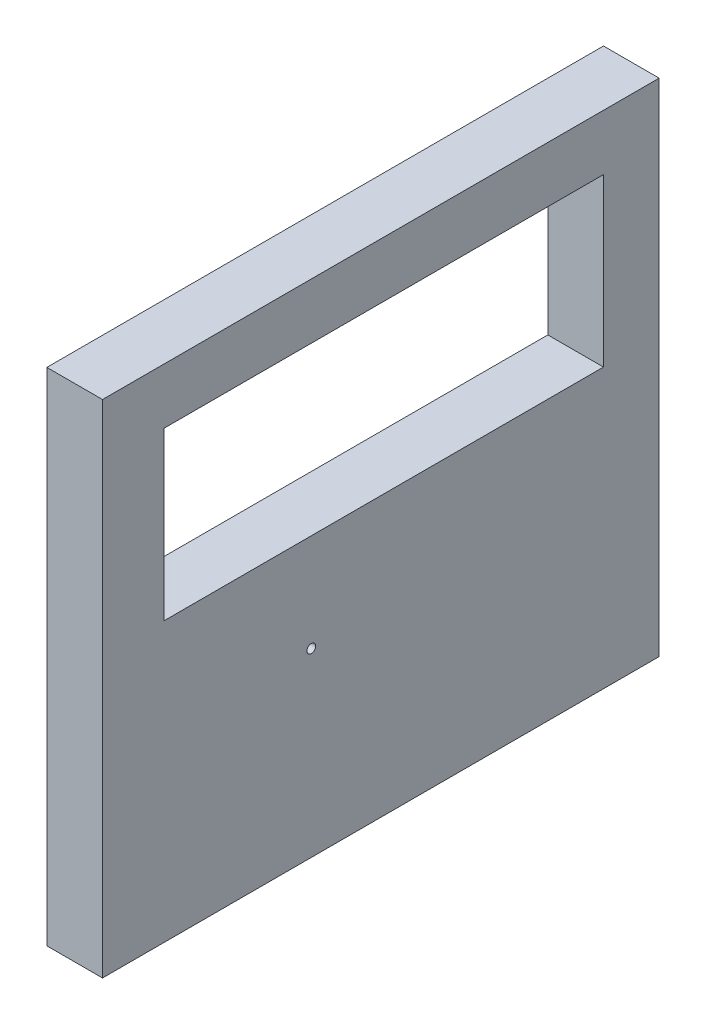
from build123d import *

# Parameters (mm, degrees)
SKETCH4_W           = 25.4
SKETCH4_H           = 228.6
BOSS_EXTRUDE1_DEPTH = 254
CUT_EXTRUDE3_DEPTH  = 280.688487428
SKETCH12_R          = 2
CUT_EXTRUDE4_DEPTH  = 280.688487428


with BuildPart() as part:
    # Sketch4 → Boss-Extrude1 (new body)
    with BuildSketch(Plane.XY):
        Rectangle(SKETCH4_W, SKETCH4_H)
    extrude(amount=BOSS_EXTRUDE1_DEPTH)

    # Sketch11 → Cut-Extrude3 (cut, through all)
    with BuildSketch(Plane(origin=(12.7, 0, 0), x_dir=(0, 0, -1), z_dir=(1, 0, 0))):
        Polygon((-226.0000001, 88.9), (-25.4000001, 88.9), (-25.4, 12.825), (-226.0000001, 12.825), align=None)
    extrude(amount=-CUT_EXTRUDE3_DEPTH, mode=Mode.SUBTRACT)

    # Sketch12 → Cut-Extrude4 (cut, through all)
    with BuildSketch(Plane(origin=(12.7, 0, 0), x_dir=(0, 0, -1), z_dir=(1, 0, 0))):
        with Locations((-158.75, -31.75)):
            Circle(SKETCH12_R)
    extrude(amount=-CUT_EXTRUDE4_DEPTH, mode=Mode.SUBTRACT)


solid = part.part
